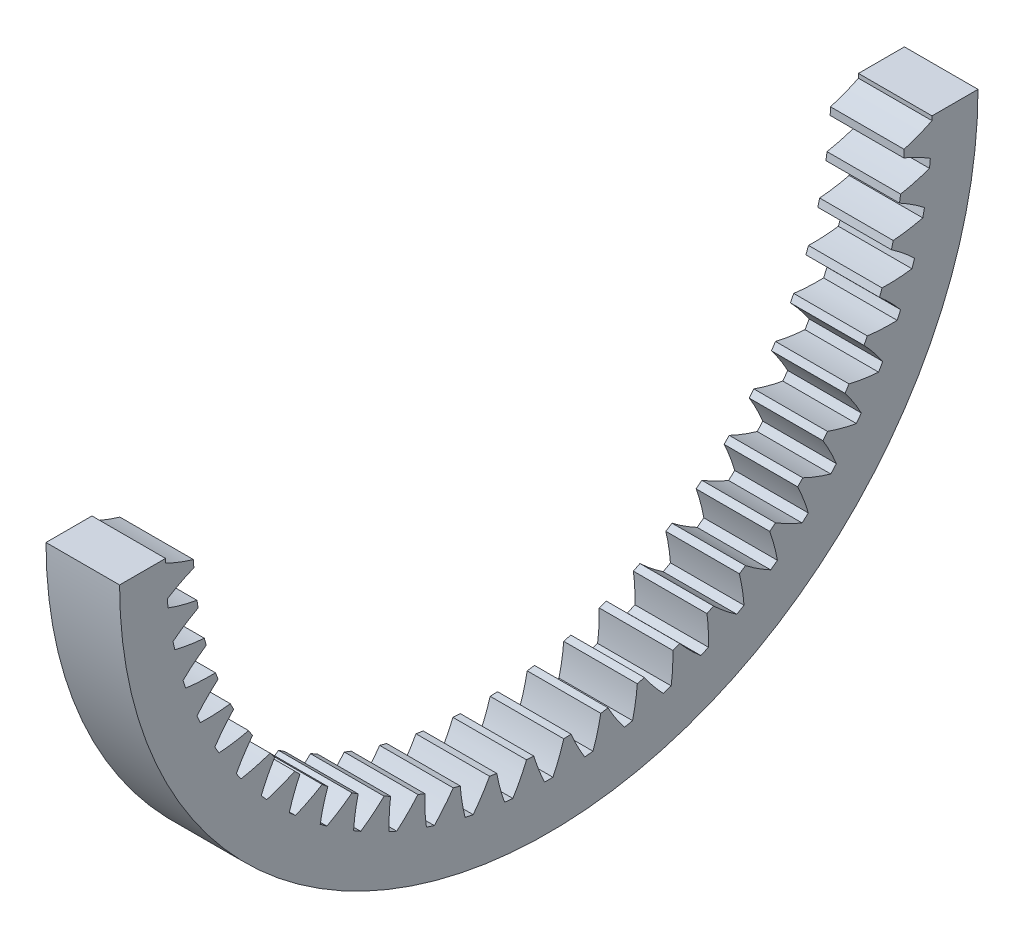
from build123d import *

# Parameters (mm, degrees)
BASPROSKE_W           = 3
BASPROSKE_H           = 3
TOOTHCUT_DEPTH        = 25.929901725
TEETHCUTS_COUNT       = 60
TEETHCUTS_ANGLE       = 354
CROQUIS2_W            = 41.366506873
CROQUIS2_H            = 18.973334131
CORTAR_EXTRUIR1_DEPTH = 25.929901725


with BuildPart() as part:
    # BasProSke → Base-Revolve (revolve)
    with BuildSketch(Plane(origin=(0, 0, 0), x_dir=(1, 0, 0), z_dir=(0, 1, 0)), mode=Mode.PRIVATE) as base_revolve_sk:
        with Locations((1.5, 16)):
            Rectangle(BASPROSKE_W, BASPROSKE_H)
    revolve(base_revolve_sk.sketch.rotate(Axis((-10, 0, 0), (1, 0, 0)), 180), axis=Axis((-10, 0, 0), (1, 0, 0)))

    # TooCutSke → ToothCut (cut, through all)
    with BuildSketch(Plane(origin=(0, 0, 0), x_dir=(0, 0, -1), z_dir=(1, 0, 0))):
        with BuildLine():
            ThreePointArc((0.61745169, 14.4614245), (0.417714459, 15.052577068), (0.16952843, 15.625080355))
            ThreePointArc((0.16952843, 15.625080355), (0, 15.626), (-0.16952843, 15.625080355))
            ThreePointArc((-0.16952843, 15.625080355), (-0.417714459, 15.052577068), (-0.61745169, 14.4614245))
            ThreePointArc((-0.61745169, 14.4614245), (0, 14.4746), (0.61745169, 14.4614245))
        make_face()
    toothcut = extrude(amount=TOOTHCUT_DEPTH, mode=Mode.SUBTRACT)

    # TeethCuts: ToothCut ×60 about axis
    teethcuts_axis = Axis((-10, 0, 0), (1, 0, 0))
    for i in range(1, TEETHCUTS_COUNT):
        add(toothcut.rotate(teethcuts_axis, i * TEETHCUTS_ANGLE / (TEETHCUTS_COUNT - 1)), mode=Mode.SUBTRACT)

    # Croquis2 → Cortar-Extruir1 (cut, through all)
    with BuildSketch(Plane(origin=(0, 0, 0), x_dir=(0, 0, -1), z_dir=(1, 0, 0))):
        with Locations((-0.529949999, 9.486667066)):
            Rectangle(CROQUIS2_W, CROQUIS2_H)
    extrude(amount=CORTAR_EXTRUIR1_DEPTH, mode=Mode.SUBTRACT)


solid = part.part
